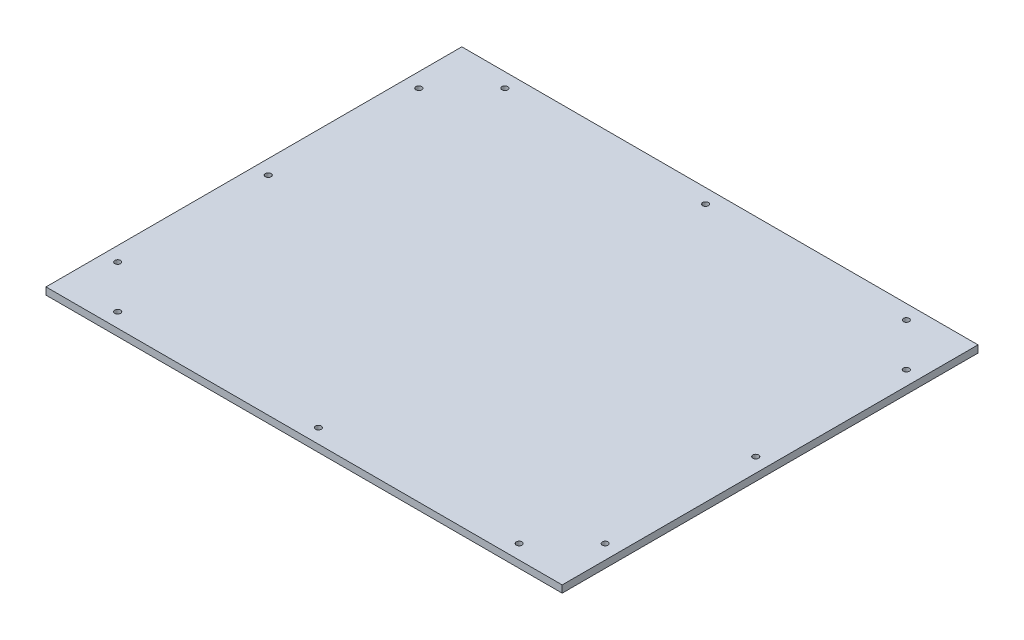
from build123d import *

# Parameters (mm, degrees)
SKETCH1_W           = 457.2
SKETCH1_H           = 368.3
SKETCH1_R           = 2.5527
BOSS_EXTRUDE1_DEPTH = 6.35


with BuildPart() as part:
    # Sketch1 → Boss-Extrude1 (new body)
    with BuildSketch(Plane(origin=(0, 0, 0), x_dir=(1, 0, 0), z_dir=(0, 1, 0))):
        with Locations((228.6, 184.15)):
            Rectangle(SKETCH1_W, SKETCH1_H)
        with Locations(Location((50.8, 355.6, 0), (0, 0, 270))):
            Circle(SKETCH1_R, mode=Mode.SUBTRACT)
        with Locations(Location((406.4, 355.6, 0), (0, 0, 270))):
            Circle(SKETCH1_R, mode=Mode.SUBTRACT)
        with Locations(Location((406.4, 12.7, 0), (0, 0, 270))):
            Circle(SKETCH1_R, mode=Mode.SUBTRACT)
        with Locations(Location((50.8, 12.7, 0), (0, 0, 270))):
            Circle(SKETCH1_R, mode=Mode.SUBTRACT)
        with Locations(Location((228.6, 12.7, 0), (0, 0, 270))):
            Circle(SKETCH1_R, mode=Mode.SUBTRACT)
        with Locations(Location((228.6, 355.6, 0), (0, 0, 270))):
            Circle(SKETCH1_R, mode=Mode.SUBTRACT)
        with Locations(Location((12.7, 184.15, 0), (0, 0, 270))):
            Circle(SKETCH1_R, mode=Mode.SUBTRACT)
        with Locations(Location((444.5, 184.15, 0), (0, 0, 270))):
            Circle(SKETCH1_R, mode=Mode.SUBTRACT)
        with Locations(Location((12.7, 50.8, 0), (0, 0, 270))):
            Circle(SKETCH1_R, mode=Mode.SUBTRACT)
        with Locations(Location((444.5, 50.8, 0), (0, 0, 270))):
            Circle(SKETCH1_R, mode=Mode.SUBTRACT)
        with Locations(Location((444.5, 317.5, 0), (0, 0, 270))):
            Circle(SKETCH1_R, mode=Mode.SUBTRACT)
        with Locations(Location((12.7, 317.5, 0), (0, 0, 270))):
            Circle(SKETCH1_R, mode=Mode.SUBTRACT)
    extrude(amount=BOSS_EXTRUDE1_DEPTH)


solid = part.part
